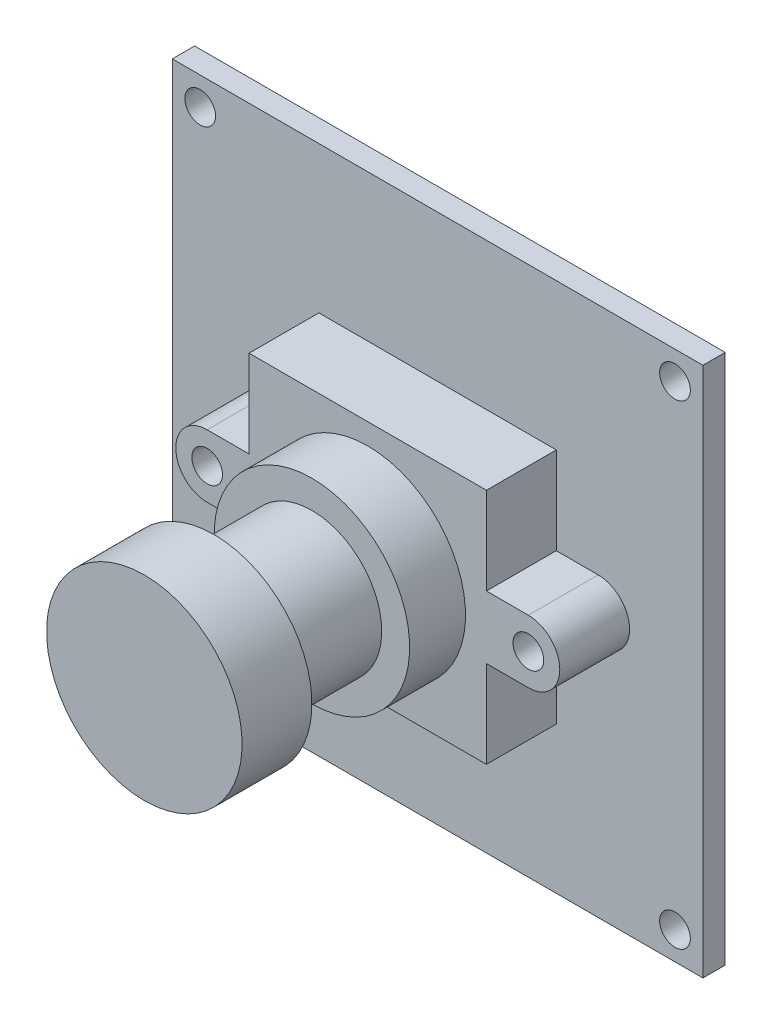
from build123d import *

# Parameters (mm, degrees)
SKETCH_1_W      = 38
SKETCH_1_H      = 38
SKETCH_1_R      = 1.1
EXTRUDE_2_DEPTH = 1.6
SKETCH_1_4_W    = 17
SKETCH_1_4_H    = 17
SKETCH_1_4_R    = 1.1
EXTRUDE_3_DEPTH = 5
EXTRUDE_START   = -1.6
SKETCH_4_W      = 6
SKETCH_4_H      = 3
SKETCH_4_W_2    = 9
EXTRUDE_4_DEPTH = 8.3


with BuildPart() as part:
    # 草图1 → 凸台-拉伸2 (new body)
    with BuildSketch(Plane.XY):
        Rectangle(SKETCH_1_W, SKETCH_1_H)
        with Locations((-17, 17)):
            Circle(SKETCH_1_R, mode=Mode.SUBTRACT)
        with Locations((17, 17)):
            Circle(SKETCH_1_R, mode=Mode.SUBTRACT)
        with Locations((17, -17)):
            Circle(SKETCH_1_R, mode=Mode.SUBTRACT)
        with Locations((-17, -17)):
            Circle(SKETCH_1_R, mode=Mode.SUBTRACT)
    extrude(amount=-EXTRUDE_2_DEPTH)

    # 草图1<4> → 凸台-拉伸3 (add)
    # profile 1 of 2: a face of its own
    with BuildSketch(Plane.XY):
        Rectangle(SKETCH_1_4_W, SKETCH_1_4_H)
    # profile 2 of 2: a face of its own
    with BuildSketch(Plane.XY):
        with BuildLine():
            Line((-11.5, 2.25), (11.5, 2.25))
            ThreePointArc((11.5, 2.25), (13.75, 0), (11.5, -2.25))
            Line((11.5, -2.25), (-11.5, -2.25))
            ThreePointArc((-11.5, -2.25), (-13.75, 0), (-11.5, 2.25))
        make_face()
        with Locations((11.5, 0)):
            Circle(SKETCH_1_4_R, mode=Mode.SUBTRACT)
        with Locations((-11.5, 0)):
            Circle(SKETCH_1_4_R, mode=Mode.SUBTRACT)
    extrude(amount=EXTRUDE_3_DEPTH)

    # 草图3 → 旋转3 (revolve)
    with BuildSketch(Plane(origin=(0, 0, 0), x_dir=(0, 0, -1), z_dir=(1, 0, 0))):
        Polygon((-5, 0), (-9, 0), (-16, 0), (-21, 0), (-21, 7), (-16, 7), (-16, 5), (-9, 5), (-9, 7), (-5, 7), align=None)
    revolve(axis=Axis((0, 0, 5), (0, 0, 1)))

    # 草图4 → 凸台-拉伸4 (add)
    with BuildSketch(Plane(origin=(0, 0, -1.6), x_dir=(-1, 0, 0), z_dir=(0, 0, -1)).offset(EXTRUDE_START)):
        with Locations((-9, -15.3)):
            Rectangle(SKETCH_4_W, SKETCH_4_H)
        with Locations((2, -15.3)):
            Rectangle(SKETCH_4_W_2, SKETCH_4_H)
    extrude(amount=EXTRUDE_4_DEPTH)


solid = part.part
